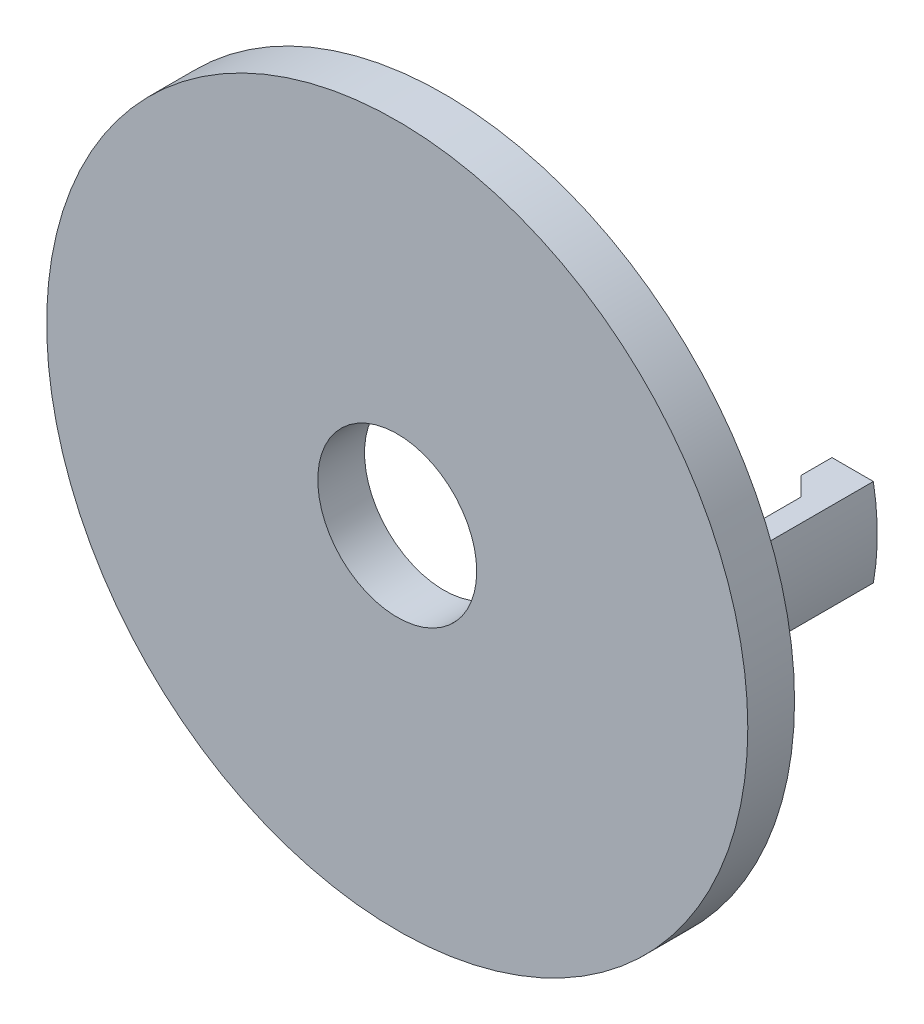
from build123d import *

# Parameters (mm, degrees)
SKETCH4_R           = 37.5
BOSS_EXTRUDE2_DEPTH = 5
SKETCH5_R           = 8.5
CUT_EXTRUDE1_DEPTH  = 54.268189382
BOSS_EXTRUDE3_DEPTH = 4.7
SKETCH1_R           = 37.5
SKETCH1_R_2         = 26.5
CUT_EXTRUDE2_DEPTH  = 57.626164447


with BuildPart() as part:
    # Sketch4 → Boss-Extrude2 (new body)
    with BuildSketch(Plane.XY):
        Circle(SKETCH4_R)
    extrude(amount=BOSS_EXTRUDE2_DEPTH)

    # Sketch5 → Cut-Extrude1 (cut, through all)
    with BuildSketch(Plane.XY.offset(5)):
        Circle(SKETCH5_R)
    extrude(amount=-CUT_EXTRUDE1_DEPTH, mode=Mode.SUBTRACT)

    # Sketch6 → Boss-Extrude3 (add, symmetric)
    with BuildSketch(Plane(origin=(0, 0, 0), x_dir=(1, 0, 0), z_dir=(0, 1, 0))):
        Polygon((26.5, 0), (20.712132034, 0), (23.65, 2.937867966), (23.65, 14.562132034), (21.65, 16.562132034), (21.65, 19.85), (26.5, 19.85), align=None)
    boss_extrude3 = extrude(amount=BOSS_EXTRUDE3_DEPTH, both=True)

    # Mirror1: Boss-Extrude3 across plane
    add(boss_extrude3.mirror(Plane(origin=(0, 0, 0), x_dir=(0, 0, 1), z_dir=(1, 0, 0))))

    # Sketch1 → Cut-Extrude2 (cut, through all)
    with BuildSketch(Plane.XY):
        Circle(SKETCH1_R)
        Circle(SKETCH1_R_2, mode=Mode.SUBTRACT)
    extrude(amount=-CUT_EXTRUDE2_DEPTH, mode=Mode.SUBTRACT)


solid = part.part
